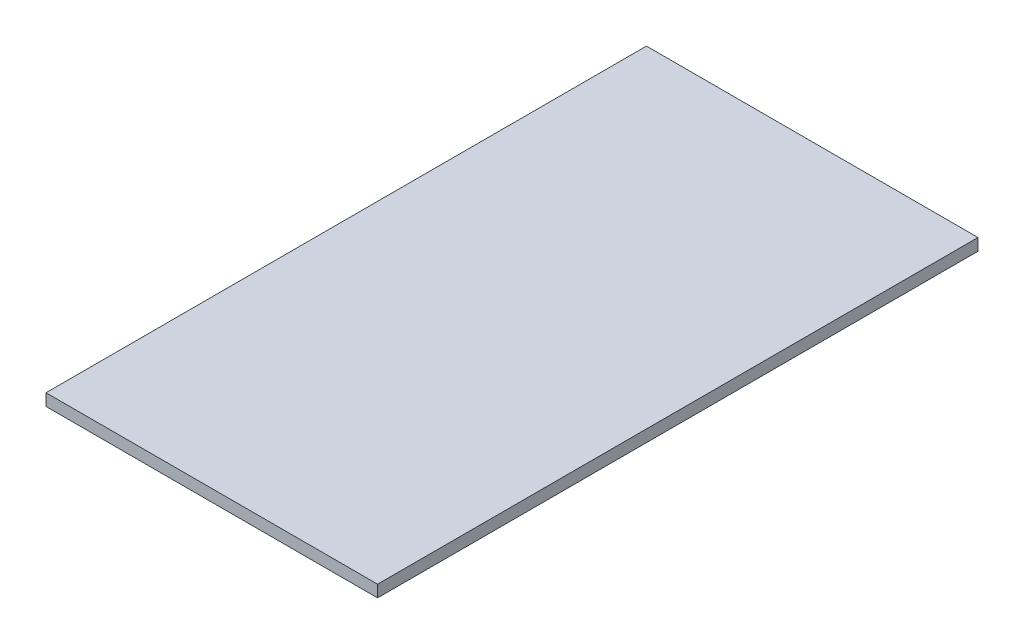
from build123d import *

# Parameters (mm, degrees)
SKETCH1_W           = 88.35
SKETCH1_H           = 160
BOSS_EXTRUDE1_DEPTH = 3.175


with BuildPart() as part:
    # Sketch1 → Boss-Extrude1 (new body)
    with BuildSketch(Plane(origin=(0, 0, 0), x_dir=(1, 0, 0), z_dir=(0, 1, 0))):
        with Locations((44.175, 80)):
            Rectangle(SKETCH1_W, SKETCH1_H)
    extrude(amount=BOSS_EXTRUDE1_DEPTH)


solid = part.part
